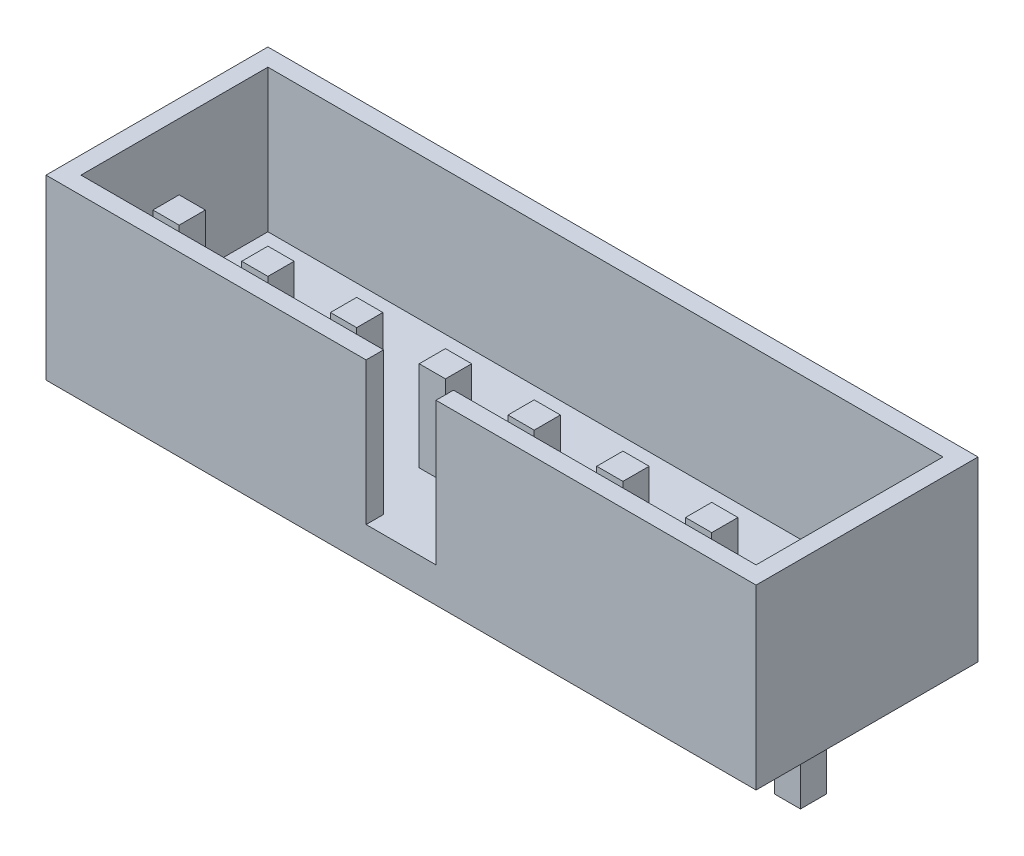
from build123d import *

# Parameters (mm, degrees)
SKETCH_1_W           = 20.32
SKETCH_1_H           = 6.35
EXTRUDE_1_DEPTH      = 5.08
SKETCH_2_W           = 19.32
SKETCH_2_H           = 5.35
CUT_EXTRUDE_1_DEPTH  = 4.08
SKETCH_3_W           = 2
SKETCH_3_H           = 4.08
CUT_EXTRUDE_2_DEPTH  = 1
EXTRUDE_2_DEPTH      = 2
EXTRUDE_2_DEPTH_BACK = 3.58
SKETCH_4_W           = 0.75
SKETCH_4_H           = 0.75


with BuildPart() as part:
    # 草图1 → 拉伸1 (new body)
    with BuildSketch(Plane(origin=(0, 0, 0), x_dir=(1, 0, 0), z_dir=(0, 1, 0))):
        Rectangle(SKETCH_1_W, SKETCH_1_H)
    extrude(amount=EXTRUDE_1_DEPTH)

    # 草图2 → 切除-拉伸1 (cut)
    with BuildSketch(Plane(origin=(0, 5.08, 0), x_dir=(-1, 0, 0), z_dir=(0, 1, 0))):
        Rectangle(SKETCH_2_W, SKETCH_2_H)
    extrude(amount=-CUT_EXTRUDE_1_DEPTH, mode=Mode.SUBTRACT)

    # 草图3 → 切除-拉伸2 (cut)
    with BuildSketch(Plane.XY.offset(3.175)):
        with Locations((0, 3.04)):
            Rectangle(SKETCH_3_W, SKETCH_3_H)
    extrude(amount=-CUT_EXTRUDE_2_DEPTH, mode=Mode.SUBTRACT)

    # 草图4 → 拉伸2 (add, two sides: drawn at the far end of the back side and taken through both)
    with BuildSketch(Plane.XZ.offset(-EXTRUDE_2_DEPTH_BACK)):
        with Locations((-1.27, 0.635)):
            Rectangle(SKETCH_4_W, SKETCH_4_H)
        with Locations((1.27, 0.635)):
            Rectangle(SKETCH_4_W, SKETCH_4_H)
        with Locations((3.81, 0.635)):
            Rectangle(SKETCH_4_W, SKETCH_4_H)
        with Locations((6.35, 0.635)):
            Rectangle(SKETCH_4_W, SKETCH_4_H)
        with Locations((-3.81, 0.635)):
            Rectangle(SKETCH_4_W, SKETCH_4_H)
        with Locations((-6.35, 0.635)):
            Rectangle(SKETCH_4_W, SKETCH_4_H)
        with Locations((-8.89, 0.635)):
            Rectangle(SKETCH_4_W, SKETCH_4_H)
        with Locations((8.89, 0.635)):
            Rectangle(SKETCH_4_W, SKETCH_4_H)
    extrude(amount=EXTRUDE_2_DEPTH + EXTRUDE_2_DEPTH_BACK)


solid = part.part
